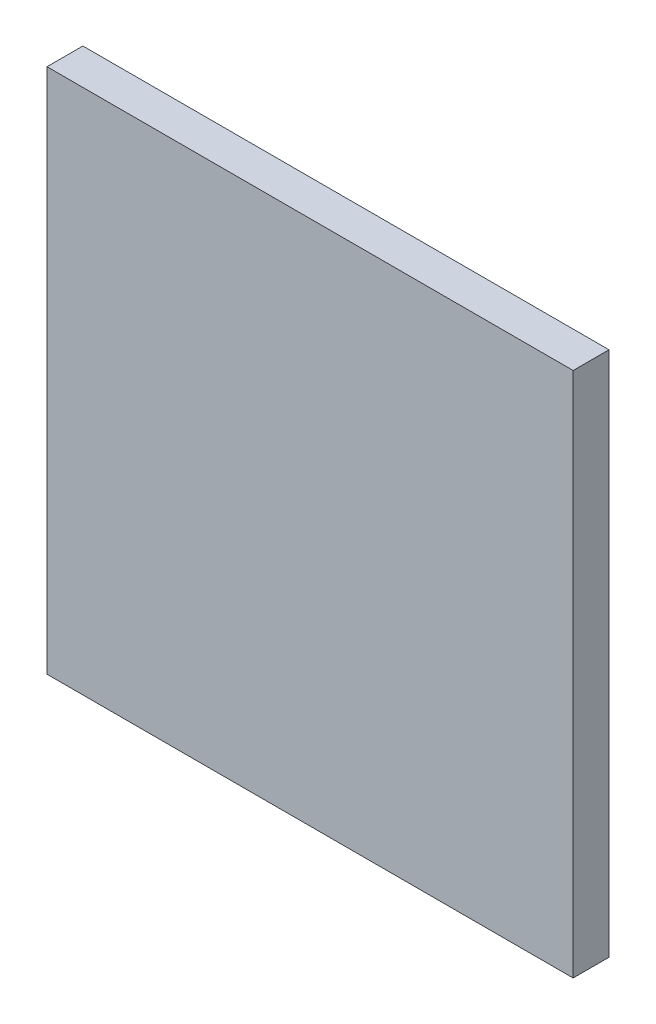
from build123d import *

# Parameters (mm, degrees)
SKETCH1_W           = 22
SKETCH1_H           = 22
BOSS_EXTRUDE1_DEPTH = 1.5


with BuildPart() as part:
    # Sketch1 → Boss-Extrude1 (new body)
    with BuildSketch(Plane.XY):
        Rectangle(SKETCH1_W, SKETCH1_H)
    extrude(amount=BOSS_EXTRUDE1_DEPTH)


solid = part.part
